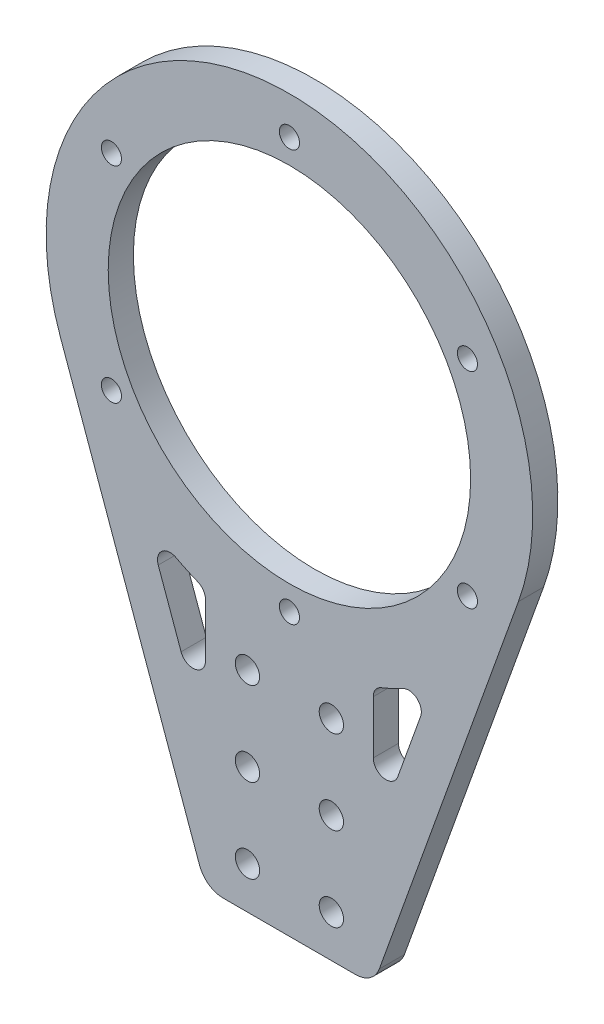
from build123d import *

# Parameters (mm, degrees)
SKETCH_2_R          = 21.6
SKETCH_2_R_2        = 1.2
EXTRUDE_1_DEPTH     = 3
FILLET_1_R          = 1.5
SKETCH_3_R          = 1.45
CUT_EXTRUDE_1_DEPTH = 5
FILLET_2_R          = 3


with BuildPart() as part:
    # 草图2 → 凸台-拉伸1 (new body)
    with BuildSketch(Plane.XY):
        with BuildLine():
            Line((-10, -58), (10, -58))
            Line((10, -58), (27.296195268, -9.793759437))
            ThreePointArc((27.296195268, -9.793759437), (0, 29), (-27.296195268, -9.793759437))
            Line((-27.296195268, -9.793759437), (-10, -58))
        make_face()
        Circle(SKETCH_2_R, mode=Mode.SUBTRACT)
        with Locations((0, 24.5)):
            Circle(SKETCH_2_R_2, mode=Mode.SUBTRACT)
        with Locations((21.217622393, 12.25)):
            Circle(SKETCH_2_R_2, mode=Mode.SUBTRACT)
        with Locations((21.217622393, -12.25)):
            Circle(SKETCH_2_R_2, mode=Mode.SUBTRACT)
        with Locations((0, -24.5)):
            Circle(SKETCH_2_R_2, mode=Mode.SUBTRACT)
        with Locations((-21.217622393, -12.25)):
            Circle(SKETCH_2_R_2, mode=Mode.SUBTRACT)
        with Locations((-21.217622393, 12.25)):
            Circle(SKETCH_2_R_2, mode=Mode.SUBTRACT)
        with BuildLine():
            Line((-10, -43.194653704), (-10, -27.221315178))
            ThreePointArc((-10, -27.221315178), (-13.678333165, -25.571531081), (-17.09233909, -23.427589386))
            Line((-17.09233909, -23.427589386), (-10, -43.194653704))
        make_face(mode=Mode.SUBTRACT)
        with BuildLine():
            Line((10, -43.194653704), (10, -27.221315178))
            ThreePointArc((10, -27.221315178), (13.678333165, -25.571531081), (17.09233909, -23.427589386))
            Line((17.09233909, -23.427589386), (10, -43.194653704))
        make_face(mode=Mode.SUBTRACT)
    extrude(amount=EXTRUDE_1_DEPTH)

    # 圆角1
    fillet_1_edges = [part.edges().sort_by_distance(p)[0] for p in [
        (17.09233909, -23.427589386, 1.5),
        (10, -43.194653704, 1.5),
        (10, -27.221315178, 1.5),
        (-10, -43.194653704, 1.5),
        (-17.09233909, -23.427589386, 1.5),
        (-10, -27.221315178, 1.5),
    ]]
    fillet(fillet_1_edges, radius=FILLET_1_R)

    # 草图3 → 切除-拉伸1 (cut)
    with BuildSketch(Plane(origin=(0, 0, 0), x_dir=(-1, 0, 0), z_dir=(0, 0, -1))):
        with Locations((-5, -33)):
            Circle(SKETCH_3_R)
        with Locations((-5, -43)):
            Circle(SKETCH_3_R)
        with Locations((-5, -53)):
            Circle(SKETCH_3_R)
        with Locations((5, -53)):
            Circle(SKETCH_3_R)
        with Locations((5, -43)):
            Circle(SKETCH_3_R)
        with Locations((5, -33)):
            Circle(SKETCH_3_R)
    extrude(amount=-CUT_EXTRUDE_1_DEPTH, mode=Mode.SUBTRACT)

    # 圆角2
    fillet_2_edges = [part.edges().sort_by_distance(p)[0] for p in [
        (-10, -58, 1.5),
        (10, -58, 1.5),
    ]]
    fillet(fillet_2_edges, radius=FILLET_2_R)


solid = part.part
